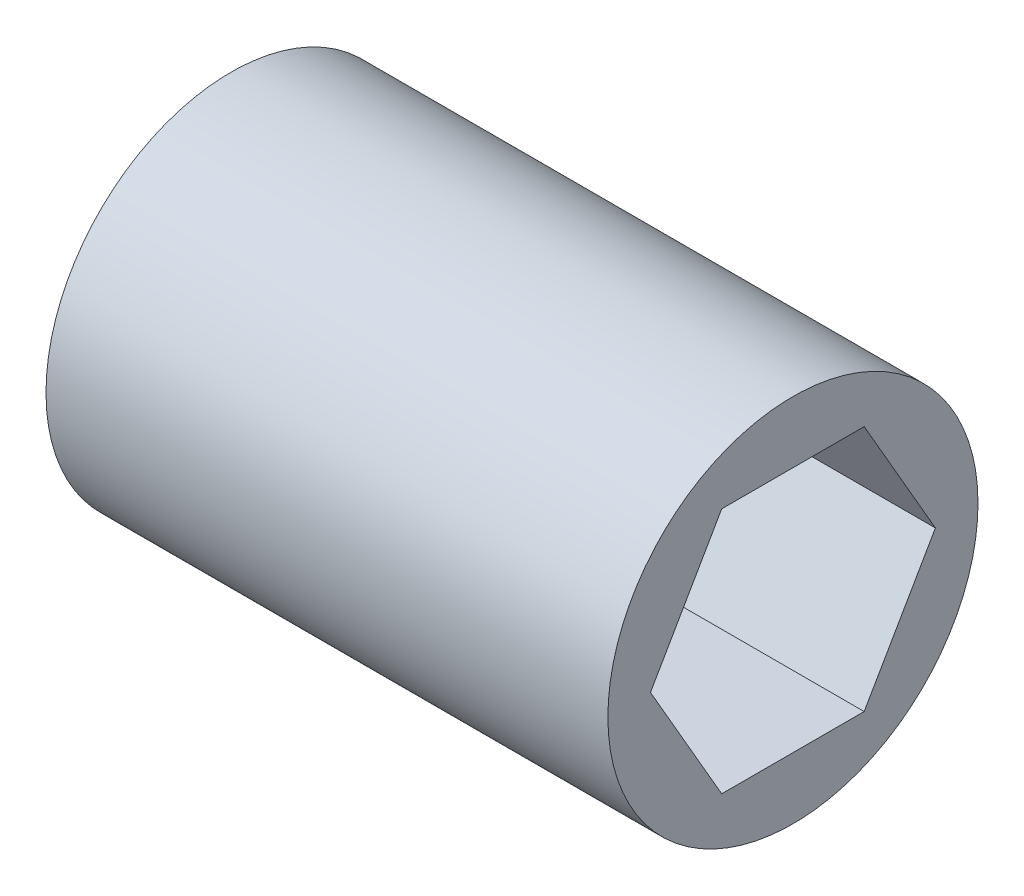
from build123d import *

# Parameters (mm, degrees)
SKETCH1_R           = 9.525
BOSS_EXTRUDE1_DEPTH = 14.46


with BuildPart() as part:
    # Sketch1 → Boss-Extrude1 (new, symmetric)
    with BuildSketch(Plane(origin=(0, 0, 0), x_dir=(0, 0, -1), z_dir=(1, 0, 0))):
        Circle(SKETCH1_R)
        Polygon((7.332348419, 0), (3.666174209, 6.35), (-3.666174209, 6.35), (-7.332348419, 0), (-3.666174209, -6.35), (3.666174209, -6.35), align=None, mode=Mode.SUBTRACT)
    extrude(amount=BOSS_EXTRUDE1_DEPTH, both=True)


solid = part.part
